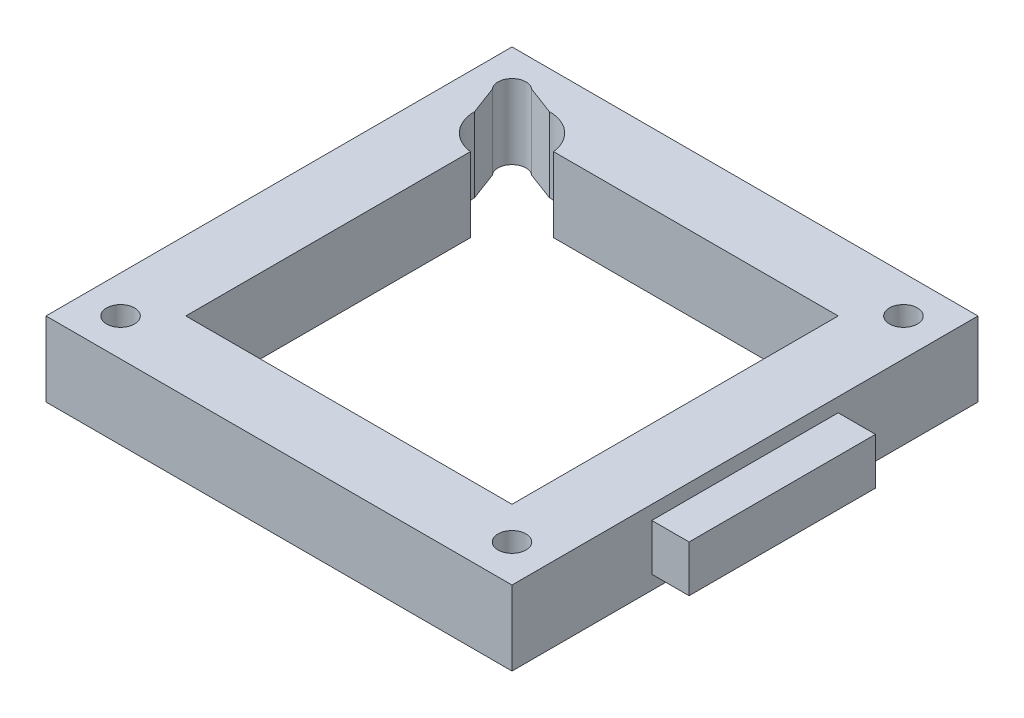
from build123d import *

# Parameters (mm, degrees)
SKETCH1_W        = 50
SKETCH1_H        = 50
SKETCH1_R        = 1.5
SUPPORT_DEPTH    = 8
NORTH_START      = -25
SKETCH2_W        = 20
SKETCH2_H        = 5
NORTH_CUT_DEPTH  = 4
EAST_START       = 25
SKETCH3_W        = 20
SKETCH3_H        = 5
EAST_DOWEL_DEPTH = 4


with BuildPart() as part:
    # Sketch1 → Support (new body)
    with BuildSketch(Plane(origin=(0, 0, 0), x_dir=(1, 0, 0), z_dir=(0, 1, 0))):
        Rectangle(SKETCH1_W, SKETCH1_H)
        with Locations(Location((-21, -21, 0), (0, 0, 270))):
            Circle(SKETCH1_R, mode=Mode.SUBTRACT)
        with Locations(Location((21, -21, 0), (0, 0, 270))):
            Circle(SKETCH1_R, mode=Mode.SUBTRACT)
        with BuildLine():
            Line((-13.031373033, 17.5), (17.5, 17.5))
            Line((17.5, 17.5), (17.5, -17.5))
            Line((17.5, -17.5), (-17.5, -17.5))
            Line((-17.5, -17.5), (-17.5, 13.031373033))
            ThreePointArc((-17.5, 13.031373033), (-20, 14.354248689), (-21, 17))
            Line((-21, 17), (-22.130136986, 20.01369863))
            ThreePointArc((-22.130136986, 20.01369863), (-22.060660172, 22.060660172), (-20.01369863, 22.130136986))
            Line((-20.01369863, 22.130136986), (-17, 21))
            ThreePointArc((-17, 21), (-14.354248689, 20), (-13.031373033, 17.5))
        make_face(mode=Mode.SUBTRACT)
        with Locations(Location((21, 21, 0), (0, 0, 270))):
            Circle(SKETCH1_R, mode=Mode.SUBTRACT)
    extrude(amount=SUPPORT_DEPTH)

    # Sketch2 → North Cut (cut)
    with BuildSketch(Plane.XY.offset(NORTH_START)):
        with Locations((0, 4)):
            Rectangle(SKETCH2_W, SKETCH2_H)
    extrude(amount=NORTH_CUT_DEPTH, mode=Mode.SUBTRACT)

    # Sketch3 → East Dowel (add)
    with BuildSketch(Plane(origin=(0, 0, 0), x_dir=(0, 0, -1), z_dir=(1, 0, 0)).offset(EAST_START)):
        with Locations((0, 4)):
            Rectangle(SKETCH3_W, SKETCH3_H)
    extrude(amount=EAST_DOWEL_DEPTH)


solid = part.part
